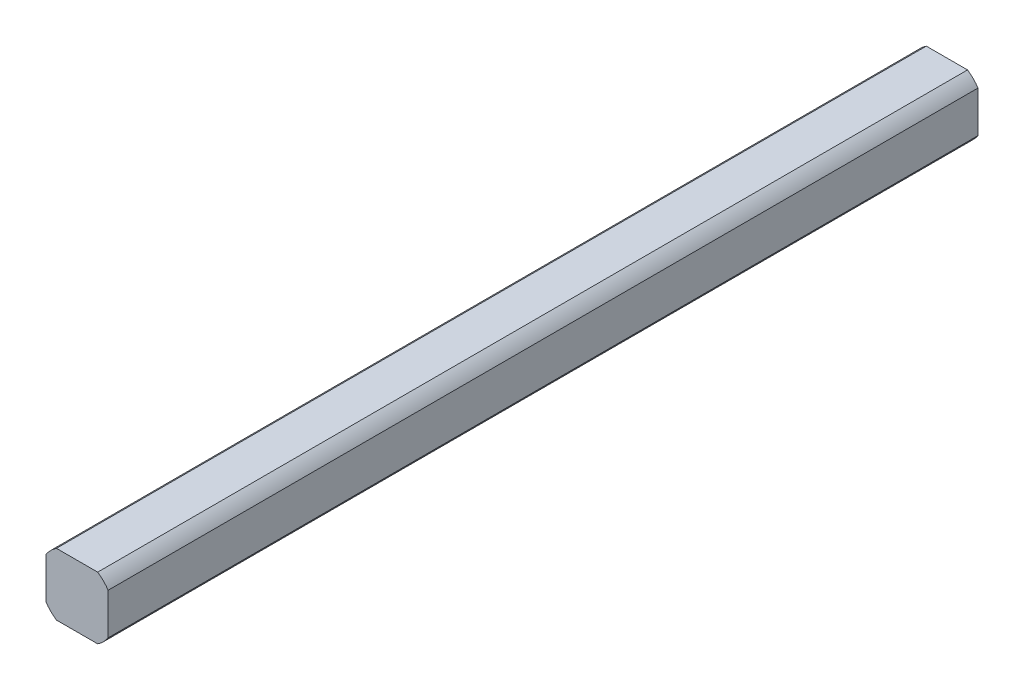
from build123d import *

# Parameters (mm, degrees)
SKETCH4_W           = 88.9
SKETCH4_H           = 6.35
BOSS_EXTRUDE1_DEPTH = 3.175
SKETCH6_OUTSIDE_W   = 26.22
SKETCH6_OUTSIDE_H   = 26.22
SKETCH6_OUTSIDE_R   = 3.81
CUT_EXTRUDE3_DEPTH  = 90.013320632


with BuildPart() as part:
    # Sketch4 → Boss-Extrude1 (new, symmetric)
    with BuildSketch(Plane(origin=(0, 0, 0), x_dir=(0, 0, -1), z_dir=(1, 0, 0))):
        with Locations((9.941503671, 0)):
            Rectangle(SKETCH4_W, SKETCH4_H)
    extrude(amount=BOSS_EXTRUDE1_DEPTH, both=True)

    # Sketch6 outside → Cut-Extrude3 (cut, through all)
    with BuildSketch(Plane.XY.offset(34.508496329)):
        Rectangle(SKETCH6_OUTSIDE_W, SKETCH6_OUTSIDE_H)
        Circle(SKETCH6_OUTSIDE_R, mode=Mode.SUBTRACT)
    extrude(amount=-CUT_EXTRUDE3_DEPTH, mode=Mode.SUBTRACT)


solid = part.part
